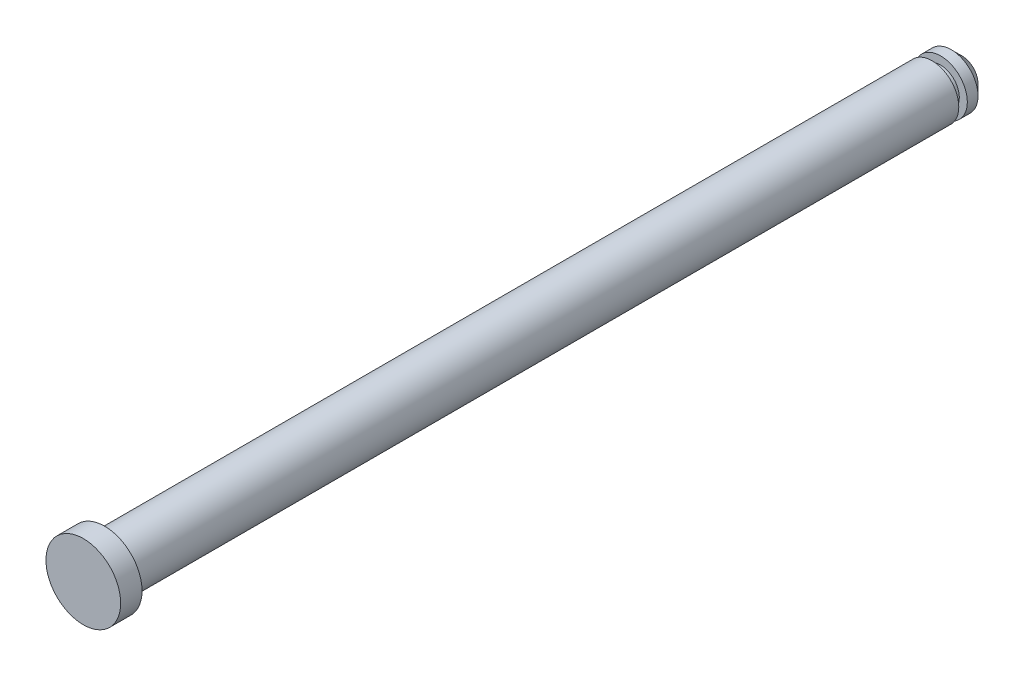
from build123d import *

# Parameters (mm, degrees)
CHAMFER_1_SIZE = 1


with BuildPart() as part:
    # 草图1 → 旋转1 (revolve)
    with BuildSketch(Plane(origin=(0, 0, 0), x_dir=(0, 0, -1), z_dir=(1, 0, 0)), mode=Mode.PRIVATE) as revolve_1_sk:
        Polygon((79.5, 2.5), (2, 2.5), (2, 3.5), (0, 3.5), (0, 0), (82.3, 0), (82.3, 2.5), (80.3, 2.5), (80.3, 1.75), (79.5, 1.75), align=None)
    revolve(revolve_1_sk.sketch.rotate(Axis((0, 0, 0), (0, 0, -1)), 90), axis=Axis((0, 0, 0), (0, 0, -1)))

    # 倒角1
    chamfer_1_edges = [part.edges().sort_by_distance(p)[0] for p in [
        (-2.5, 0, -82.3),
    ]]
    chamfer(chamfer_1_edges, length=CHAMFER_1_SIZE)


solid = part.part
